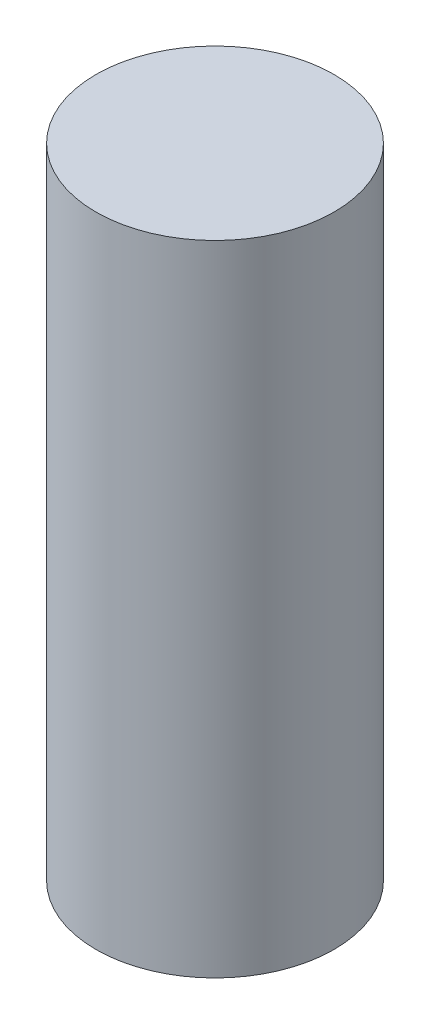
from build123d import *

# Parameters (mm, degrees)
SKETCH1_R           = 5.595
BOSS_EXTRUDE1_DEPTH = 30


with BuildPart() as part:
    # Sketch1 → Boss-Extrude1 (new body)
    with BuildSketch(Plane(origin=(0, 0, 0), x_dir=(1, 0, 0), z_dir=(0, 1, 0))):
        with Locations(Location((0, 0, 0), (0, 0, 270))):
            Circle(SKETCH1_R)
    extrude(amount=BOSS_EXTRUDE1_DEPTH)


solid = part.part
